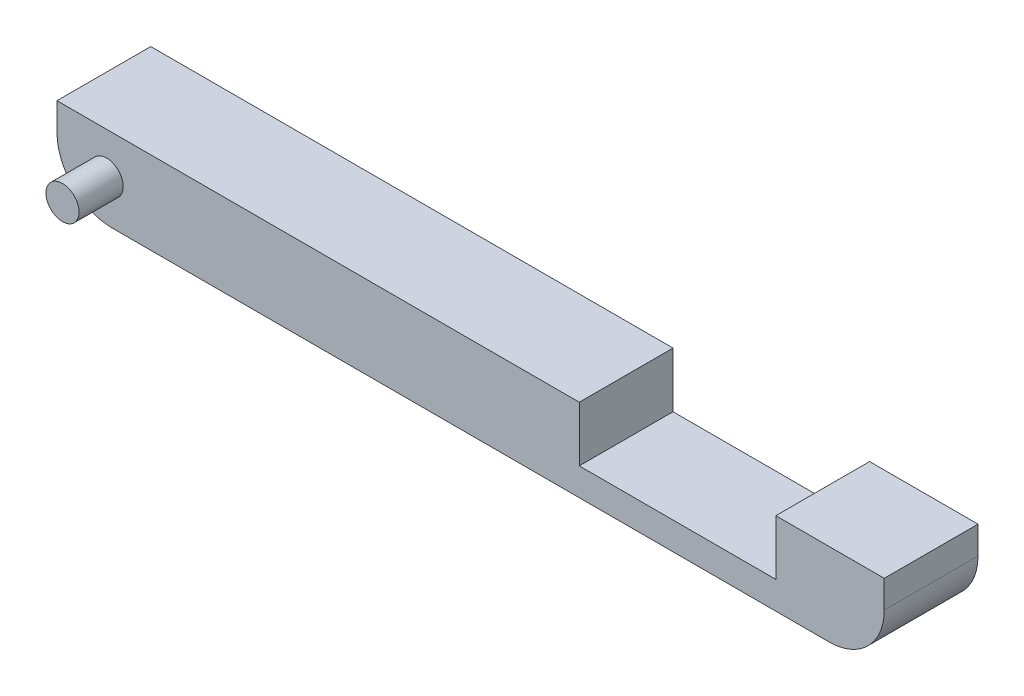
from build123d import *

# Parameters (mm, degrees)
BOSS_EXTRUDE1_DEPTH = 17
SKETCH3_R           = 3.25
CUT_EXTRUDE1_DEPTH  = 6
SKETCH4_R           = 3
BOSS_EXTRUDE2_DEPTH = 8


with BuildPart() as part:
    # Sketch2 → Boss-Extrude1 (new body)
    with BuildSketch(Plane.XY):
        with BuildLine():
            Line((-50.590688259, -20.348178138), (79.409311741, -20.348178138))
            ThreePointArc((79.409311741, -20.348178138), (86.480379553, -17.41924595), (89.409311741, -10.348178138))
            Line((89.409311741, -10.348178138), (89.409311741, -5.348178138))
            Line((89.409311741, -5.348178138), (79.409311741, -5.348178138))
            Line((79.409311741, -5.348178138), (69.749311741, -5.348178138))
            Line((69.749311741, -5.348178138), (69.749311741, -15.348178138))
            Line((69.749311741, -15.348178138), (34.109311741, -15.348178138))
            Line((34.109311741, -15.348178138), (34.109311741, -5.348178138))
            Line((34.109311741, -5.348178138), (-50.590688259, -5.348178138))
            Line((-50.590688259, -5.348178138), (-60.590688259, -5.348178138))
            Line((-60.590688259, -5.348178138), (-60.590688259, -10.348178138))
            ThreePointArc((-60.590688259, -10.348178138), (-57.661756071, -17.41924595), (-50.590688259, -20.348178138))
        make_face()
    extrude(amount=BOSS_EXTRUDE1_DEPTH)

    # Sketch3 → Cut-Extrude1 (cut)
    with BuildSketch(Plane(origin=(0, 0, 0), x_dir=(-1, 0, 0), z_dir=(0, 0, -1))):
        with Locations((-14.409311741, -12.848178138)):
            Circle(SKETCH3_R)
        with Locations((51.590688259, -12.848178138)):
            Circle(SKETCH3_R)
    extrude(amount=-CUT_EXTRUDE1_DEPTH, mode=Mode.SUBTRACT)

    # Sketch4 → Boss-Extrude2 (add)
    with BuildSketch(Plane.XY.offset(17)):
        with Locations((-51.590688259, -12.848178138)):
            Circle(SKETCH4_R)
    extrude(amount=BOSS_EXTRUDE2_DEPTH)


solid = part.part
